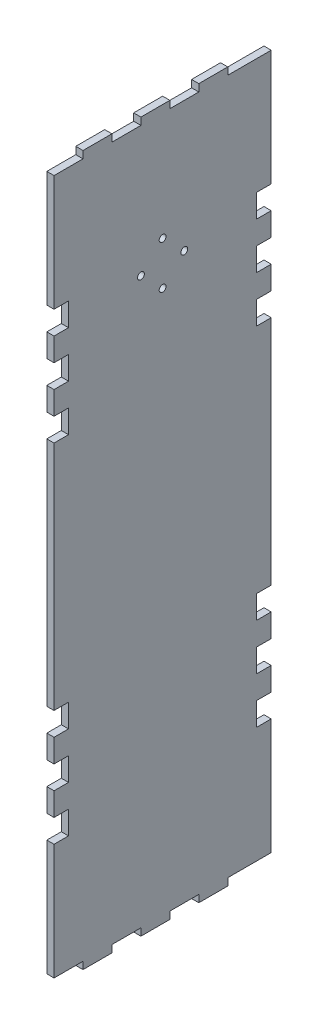
from build123d import *

# Parameters (mm, degrees)
SKETCH1_W               = 95.25
SKETCH1_H               = 311.15
BOSS_EXTRUDE1_DEPTH     = 3.175
SKETCH2_W               = 12.7
SKETCH2_H               = 3.175
SKETCH2_W_2             = 19.05
CUT_EXTRUDE1_DEPTH      = 3.175
SKETCH3_W               = 6.35
SKETCH3_H               = 10.16
CUT_EXTRUDE2_DEPTH      = 3.175
MIRROR3_COPY_1_SKETCH_W = 6.35
MIRROR3_COPY_1_SKETCH_H = 10.16
MIRROR3_COPY_1_DEPTH    = 3.175
CUT_EXTRUDE3_DEPTH      = 3.175


with BuildPart() as part:
    # Sketch1 → Boss-Extrude1 (new body)
    with BuildSketch(Plane(origin=(0, 0, 0), x_dir=(0, 0, -1), z_dir=(1, 0, 0))):
        Rectangle(SKETCH1_W, SKETCH1_H)
    extrude(amount=BOSS_EXTRUDE1_DEPTH)

    # Sketch2 → Cut-Extrude1 (cut)
    with BuildSketch(Plane(origin=(3.175, 0, 0), x_dir=(0, 0, -1), z_dir=(1, 0, 0))):
        with Locations((9.525, -153.9875)):
            Rectangle(SKETCH2_W, SKETCH2_H)
        with Locations((-15.875, -153.9875)):
            Rectangle(SKETCH2_W, SKETCH2_H)
        with Locations((-41.275, -153.9875)):
            Rectangle(SKETCH2_W, SKETCH2_H)
        with Locations((38.1, -153.9875)):
            Rectangle(SKETCH2_W_2, SKETCH2_H)
    cut_extrude1 = extrude(amount=-CUT_EXTRUDE1_DEPTH, mode=Mode.SUBTRACT)

    # Mirror1: Cut-Extrude1 across plane
    add(cut_extrude1.mirror(Plane.ZX), mode=Mode.SUBTRACT)

    # Sketch3 → Cut-Extrude2 (cut)
    with BuildSketch(Plane(origin=(3.175, 0, 0), x_dir=(0, 0, -1), z_dir=(1, 0, 0))):
        with Locations((44.45, 96.52)):
            Rectangle(SKETCH3_W, SKETCH3_H)
        with Locations((44.45, 76.2)):
            Rectangle(SKETCH3_W, SKETCH3_H)
        with Locations((44.45, 55.88)):
            Rectangle(SKETCH3_W, SKETCH3_H)
    cut_extrude2 = extrude(amount=-CUT_EXTRUDE2_DEPTH, mode=Mode.SUBTRACT)

    # Mirror2: Cut-Extrude2 across plane
    add(cut_extrude2.mirror(Plane.XY), mode=Mode.SUBTRACT)

    # Mirror3: Cut-Extrude2 across plane
    add(cut_extrude2.mirror(Plane.ZX), mode=Mode.SUBTRACT)

    # Mirror3 copy 1 sketch → Mirror3 copy 1 (cut)
    with BuildSketch(Plane(origin=(3.175, 0, 0), x_dir=(0, 0, 1), z_dir=(1, 0, 0))):
        with Locations((44.45, 96.52)):
            Rectangle(MIRROR3_COPY_1_SKETCH_W, MIRROR3_COPY_1_SKETCH_H)
        with Locations((44.45, 76.2)):
            Rectangle(MIRROR3_COPY_1_SKETCH_W, MIRROR3_COPY_1_SKETCH_H)
        with Locations((44.45, 55.88)):
            Rectangle(MIRROR3_COPY_1_SKETCH_W, MIRROR3_COPY_1_SKETCH_H)
    extrude(amount=-MIRROR3_COPY_1_DEPTH, mode=Mode.SUBTRACT)

    # Sketch5 → Cut-Extrude3 (cut)
    with BuildSketch(Plane(origin=(3.175, 0, 0), x_dir=(0, 0, -1), z_dir=(1, 0, 0))):
        with BuildLine():
            Line((1.060660172, 103.689339828), (0, 104.75))
            Line((0, 104.75), (-1.060660172, 103.689339828))
            ThreePointArc((-1.060660172, 103.689339828), (0, 103.25), (1.060660172, 103.689339828))
        make_face()
        with BuildLine():
            Line((-1.060660172, 103.689339828), (0, 104.75))
            Line((0, 104.75), (1.060660172, 103.689339828))
            ThreePointArc((1.060660172, 103.689339828), (1.385819299, 104.175974851), (1.5, 104.75))
            ThreePointArc((1.5, 104.75), (-0.574025149, 106.135819299), (-1.060660172, 103.689339828))
        make_face()
        with BuildLine():
            ThreePointArc((11, 95.25), (10.074025149, 96.635819299), (8.439339828, 96.310660172))
            Line((8.439339828, 96.310660172), (9.5, 95.25))
            Line((9.5, 95.25), (8.439339828, 94.189339828))
            ThreePointArc((8.439339828, 94.189339828), (10.074025149, 93.864180701), (11, 95.25))
        make_face()
        with BuildLine():
            Line((9.5, 95.25), (8.439339828, 96.310660172))
            ThreePointArc((8.439339828, 96.310660172), (8, 95.25), (8.439339828, 94.189339828))
            Line((8.439339828, 94.189339828), (9.5, 95.25))
        make_face()
        with BuildLine():
            ThreePointArc((-8, 95.25), (-8.114180701, 95.824025149), (-8.439339828, 96.310660172))
            Line((-8.439339828, 96.310660172), (-9.5, 95.25))
            Line((-9.5, 95.25), (-8.439339828, 94.189339828))
            ThreePointArc((-8.439339828, 94.189339828), (-8.114180701, 94.675974851), (-8, 95.25))
        make_face()
        with BuildLine():
            Line((-9.5, 95.25), (-8.439339828, 96.310660172))
            ThreePointArc((-8.439339828, 96.310660172), (-11, 95.25), (-8.439339828, 94.189339828))
            Line((-8.439339828, 94.189339828), (-9.5, 95.25))
        make_face()
        with BuildLine():
            ThreePointArc((1.060660172, 86.810660172), (0, 87.25), (-1.060660172, 86.810660172))
            Line((-1.060660172, 86.810660172), (0, 85.75))
            Line((0, 85.75), (1.060660172, 86.810660172))
        make_face()
        with BuildLine():
            Line((0, 85.75), (-1.060660172, 86.810660172))
            ThreePointArc((-1.060660172, 86.810660172), (-0.574025149, 84.364180701), (1.5, 85.75))
            ThreePointArc((1.5, 85.75), (1.385819299, 86.324025149), (1.060660172, 86.810660172))
            Line((1.060660172, 86.810660172), (0, 85.75))
        make_face()
    extrude(amount=-CUT_EXTRUDE3_DEPTH, mode=Mode.SUBTRACT)


solid = part.part
